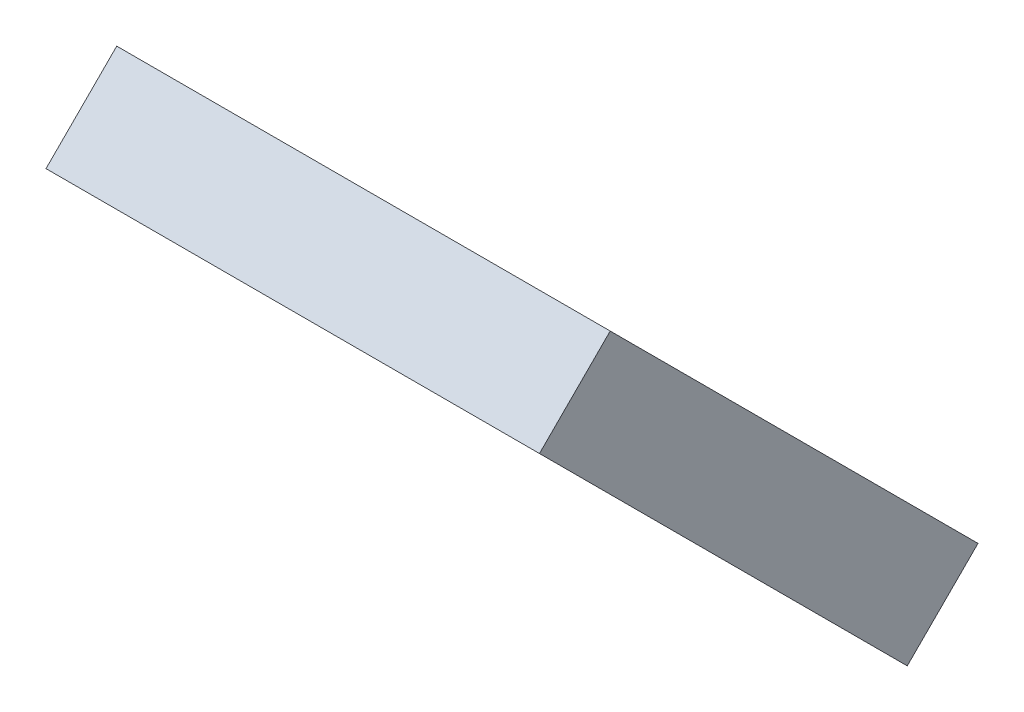
from build123d import *

# Parameters (mm, degrees)
SKETCH1_W           = 37
SKETCH1_H           = 39
SKETCH1_R           = 1.5
BOSS_EXTRUDE1_DEPTH = 7.5
SKETCH2_R           = 2
CUT_EXTRUDE1_DEPTH  = 177.665153947


with BuildPart() as part:
    # Sketch1 → Boss-Extrude1 (new body)
    with BuildSketch(Plane(origin=(0, -53.862394692, 53.862394692), x_dir=(1, 0, 0), z_dir=(0, 0.7071067811865502, -0.7071067811865449))):
        with Locations((73.844609768, -127.312236852)):
            Rectangle(SKETCH1_W, SKETCH1_H)
        with Locations(Location((88.844609768, -143.812236852, 0), (0, 0, 270))):
            Circle(SKETCH1_R, mode=Mode.SUBTRACT)
        with Locations(Location((58.844609768, -143.812236852, 0), (0, 0, 270))):
            Circle(SKETCH1_R, mode=Mode.SUBTRACT)
        with Locations(Location((58.844609768, -110.812236852, 0), (0, 0, 270))):
            Circle(SKETCH1_R, mode=Mode.SUBTRACT)
        with Locations(Location((88.844609768, -110.812236852, 0), (0, 0, 270))):
            Circle(SKETCH1_R, mode=Mode.SUBTRACT)
    extrude(amount=BOSS_EXTRUDE1_DEPTH)

    # Sketch2 → Cut-Extrude1 (cut, through all)
    with BuildSketch(Plane(origin=(0, -48.559093833, 48.559093833), x_dir=(1, 0, 0), z_dir=(0, 0.7071067811865502, -0.7071067811865449))):
        with Locations(Location((73.844609768, -131.312236852, 0), (0, 0, 270))):
            Circle(SKETCH2_R)
    extrude(amount=-CUT_EXTRUDE1_DEPTH, mode=Mode.SUBTRACT)


solid = part.part
